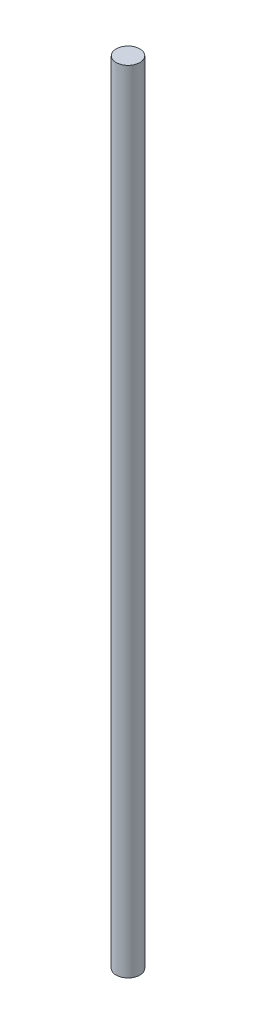
from build123d import *

# Parameters (mm, degrees)
SKETCH1_R           = 3
BOSS_EXTRUDE1_DEPTH = 100


with BuildPart() as part:
    # Sketch1 → Boss-Extrude1 (new, symmetric)
    with BuildSketch(Plane(origin=(0, 0, 0), x_dir=(1, 0, 0), z_dir=(0, 1, 0))):
        with Locations(Location((0, 0, 0), (0, 0, 270))):
            Circle(SKETCH1_R)
    extrude(amount=BOSS_EXTRUDE1_DEPTH, both=True)


solid = part.part
